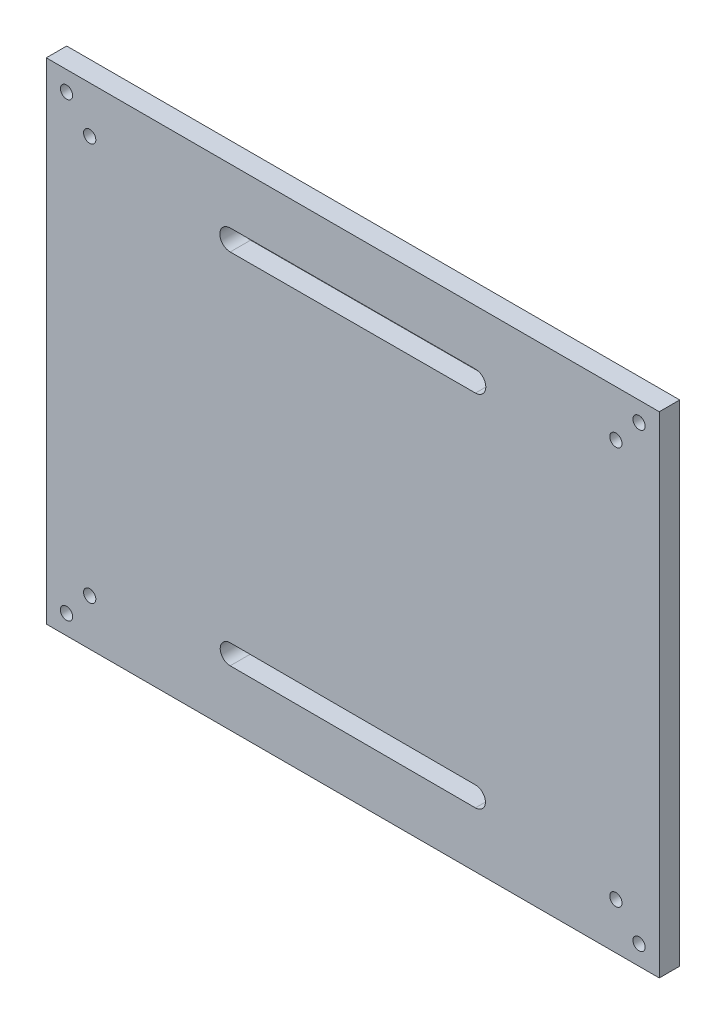
from build123d import *

# Parameters (mm, degrees)
MODEL_W             = 150
MODEL_H             = 120
MODEL_R             = 1.5
BOSS_EXTRUDE1_DEPTH = 5
CUT_EXTRUDE1_DEPTH  = 209.993753976


with BuildPart() as part:
    # Model → Boss-Extrude1 (new body)
    with BuildSketch(Plane.XY):
        with Locations((88.925313808, 69.54489837)):
            Rectangle(MODEL_W, MODEL_H)
        with Locations((18.879939798, 124.771335066)):
            Circle(MODEL_R, mode=Mode.SUBTRACT)
        with Locations((158.970687817, 124.771335066)):
            Circle(MODEL_R, mode=Mode.SUBTRACT)
        with Locations((18.879939798, 14.318461674)):
            Circle(MODEL_R, mode=Mode.SUBTRACT)
        with Locations((158.970687817, 14.318461674)):
            Circle(MODEL_R, mode=Mode.SUBTRACT)
        with Locations((24.548687541, 118.224668434)):
            Circle(MODEL_R, mode=Mode.SUBTRACT)
        with Locations((153.301940075, 118.224668434)):
            Circle(MODEL_R, mode=Mode.SUBTRACT)
        with Locations((24.548687541, 20.865128307)):
            Circle(MODEL_R, mode=Mode.SUBTRACT)
        with Locations((153.301940075, 20.865128307)):
            Circle(MODEL_R, mode=Mode.SUBTRACT)
    extrude(amount=BOSS_EXTRUDE1_DEPTH)

    # Sketch2 → Cut-Extrude1 (cut, through all)
    with BuildSketch(Plane(origin=(0, 0, 0), x_dir=(-1, 0, 0), z_dir=(0, 0, -1))):
        with BuildLine():
            Line((-58.929782285, 110.90640838), (-118.938578053, 111.011957594))
            ThreePointArc((-118.938578053, 111.011957594), (-121.474611242, 113.556927738), (-118.929641098, 116.092960927))
            Line((-118.929641098, 116.092960927), (-58.92084533, 115.987411713))
            ThreePointArc((-58.92084533, 115.987411713), (-56.384812141, 113.442441569), (-58.929782285, 110.90640838))
        make_face()
        with BuildLine():
            Line((-58.921024216, 23.204088411), (-118.929819984, 23.098539197))
            ThreePointArc((-118.929819984, 23.098539197), (-121.372907859, 25.533047888), (-118.938399168, 27.976135764))
            Line((-118.938399168, 27.976135764), (-58.9296034, 28.081684978))
            ThreePointArc((-58.9296034, 28.081684978), (-56.486515525, 25.647176286), (-58.921024216, 23.204088411))
        make_face()
    extrude(amount=-CUT_EXTRUDE1_DEPTH, mode=Mode.SUBTRACT)


solid = part.part
